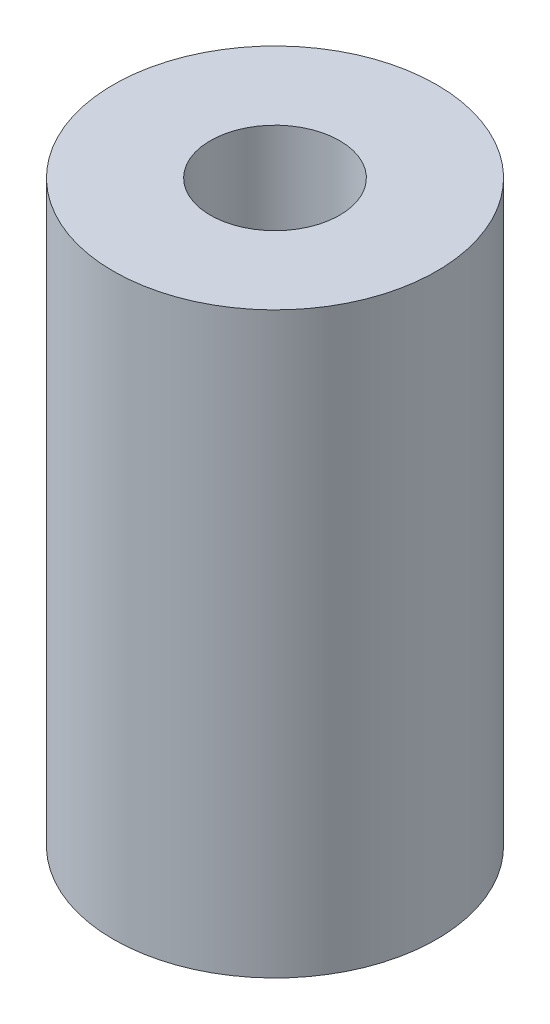
from build123d import *

# Parameters (mm, degrees)
SKETCH_1_R      = 5
SKETCH_1_R_2    = 2
EXTRUDE_1_DEPTH = 17.9


with BuildPart() as part:
    # ｽｹｯﾁ1 → ﾎﾞｽ - 押し出し1 (new body)
    with BuildSketch(Plane(origin=(0, 0, 0), x_dir=(1, 0, 0), z_dir=(0, 1, 0))):
        with Locations(Location((0, 0, 0), (0, 0, 90))):
            Circle(SKETCH_1_R)
        with Locations(Location((0, 0, 0), (0, 0, 90))):
            Circle(SKETCH_1_R_2, mode=Mode.SUBTRACT)
    extrude(amount=EXTRUDE_1_DEPTH)


solid = part.part
